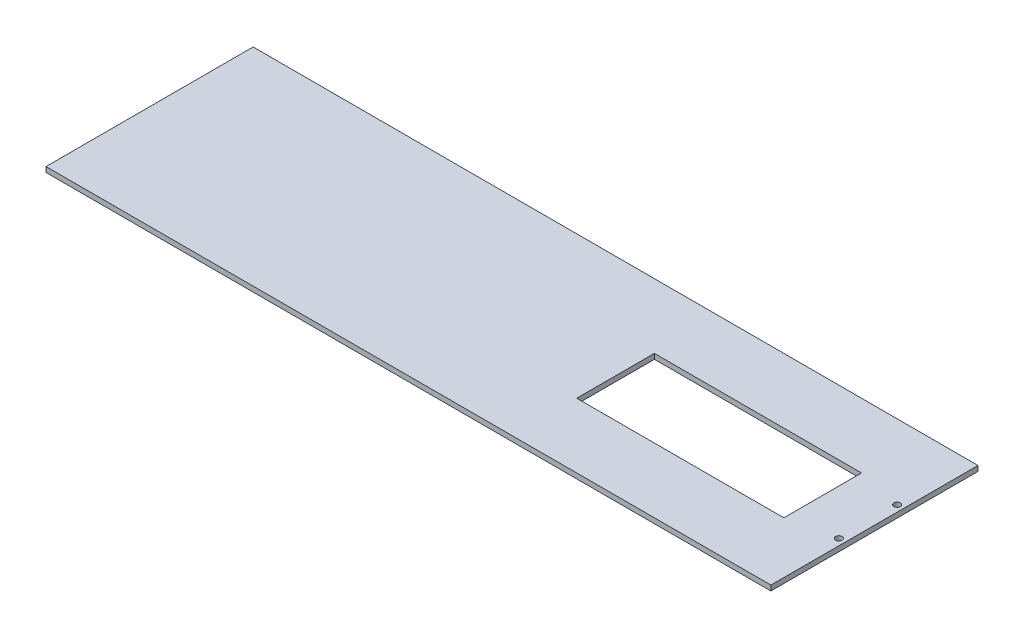
from build123d import *

# Parameters (mm, degrees)
SKETCH1_W           = 355.6
SKETCH1_H           = 101.6
BOSS_EXTRUDE1_DEPTH = 2.54
SKETCH3_R           = 1.5875
SKETCH3_W           = 101.6
SKETCH3_H           = 38.1
CUT_EXTRUDE1_DEPTH  = 2.54


with BuildPart() as part:
    # Sketch1 → Boss-Extrude1 (new body)
    with BuildSketch(Plane(origin=(0, 0, 0), x_dir=(1, 0, 0), z_dir=(0, 1, 0))):
        Rectangle(SKETCH1_W, SKETCH1_H)
    extrude(amount=BOSS_EXTRUDE1_DEPTH)

    # Sketch3 → Cut-Extrude1 (cut)
    with BuildSketch(Plane(origin=(0, 2.54, 0), x_dir=(1, 0, 0), z_dir=(0, 1, 0))):
        with Locations(Location((174.625, -14.2875, 0), (0, 0, 270))):
            Circle(SKETCH3_R)
        with Locations(Location((174.625, 14.2875, 0), (0, 0, 270))):
            Circle(SKETCH3_R)
        with Locations((101.6, 0)):
            Rectangle(SKETCH3_W, SKETCH3_H)
    extrude(amount=-CUT_EXTRUDE1_DEPTH, mode=Mode.SUBTRACT)


solid = part.part
